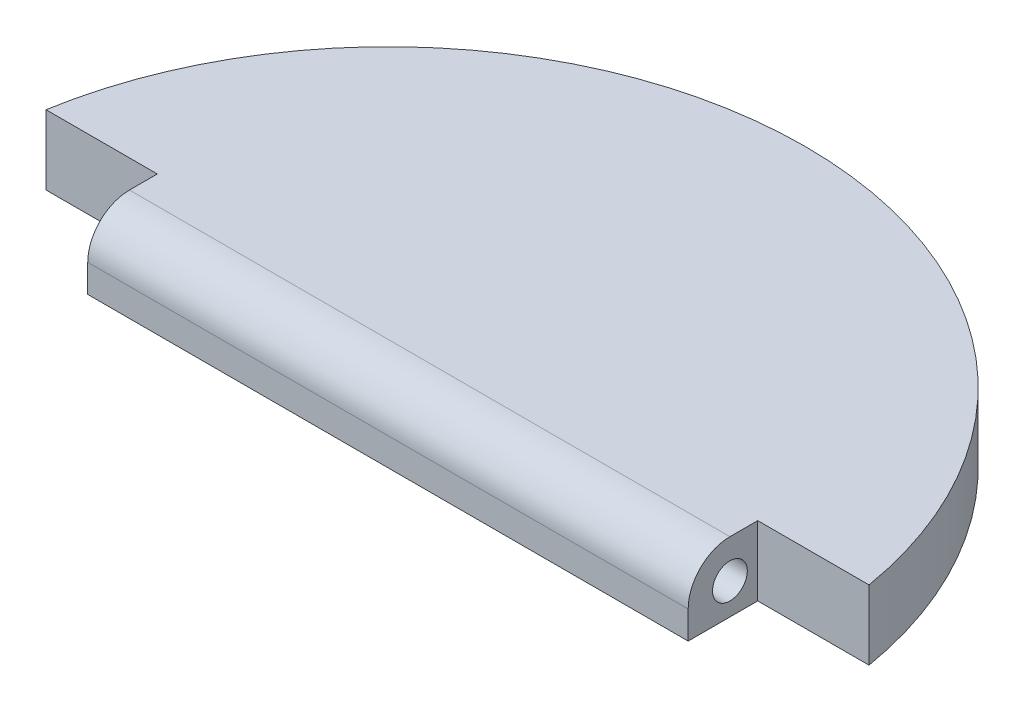
from build123d import *

# Parameters (mm, degrees)
BOSS_EXTRUDE1_DEPTH = 5
CUT_EXTRUDE1_START  = -10
CUT_EXTRUDE1_DEPTH  = 10
FILLET2_R           = 3
SKETCH6_R           = 1.25
CUT_EXTRUDE2_DEPTH  = 3
CUT_EXTRUDE3_START  = -3
SKETCH7_R           = 1.25
CUT_EXTRUDE3_DEPTH  = 3


with BuildPart() as part:
    # Sketch1 → Boss-Extrude1 (new body)
    with BuildSketch(Plane(origin=(0, 0, 0), x_dir=(1, 0, 0), z_dir=(0, 1, 0))):
        with BuildLine():
            Line((-30, 0), (30, 0))
            ThreePointArc((30, 0), (0, 30), (-30, 0))
        make_face()
    extrude(amount=BOSS_EXTRUDE1_DEPTH)

    # Sketch5 → Cut-Extrude1 (cut)
    with BuildSketch(Plane(origin=(0, 5, 0), x_dir=(1, 0, 0), z_dir=(0, 1, 0)).offset(CUT_EXTRUDE1_START)):
        with BuildLine():
            Line((-21.580398915, 0), (-21.580398915, 5))
            Line((-21.580398915, 5), (-29.580398915, 5))
            ThreePointArc((-29.580398915, 5), (-29.894915684, 2.508787808), (-30, 0))
            Line((-30, 0), (-21.580398915, 0))
        make_face()
        with BuildLine():
            Line((21.580398915, 5), (29.580398915, 5))
            ThreePointArc((29.580398915, 5), (29.894915684, 2.508787808), (30, 0))
            Line((30, 0), (21.580398915, 0))
            Line((21.580398915, 0), (21.580398915, 5))
        make_face()
    extrude(amount=CUT_EXTRUDE1_DEPTH, mode=Mode.SUBTRACT)

    # Fillet2
    fillet2_edges = [part.edges().sort_by_distance(p)[0] for p in [
        (0, 5, 0),
    ]]
    fillet(fillet2_edges, radius=FILLET2_R)

    # Sketch6 → Cut-Extrude2 (cut)
    with BuildSketch(Plane(origin=(21.580398915, 0, 0), x_dir=(0, 0, -1), z_dir=(1, 0, 0))):
        with Locations((3, 2.25)):
            Circle(SKETCH6_R)
    extrude(amount=-CUT_EXTRUDE2_DEPTH, mode=Mode.SUBTRACT)

    # Sketch7 → Cut-Extrude3 (cut)
    with BuildSketch(Plane.ZY.offset(21.580398915).offset(CUT_EXTRUDE3_START)):
        with Locations(Location((-3, 2.25, 0), (0, 0, 180))):
            Circle(SKETCH7_R)
    extrude(amount=CUT_EXTRUDE3_DEPTH, mode=Mode.SUBTRACT)


solid = part.part
